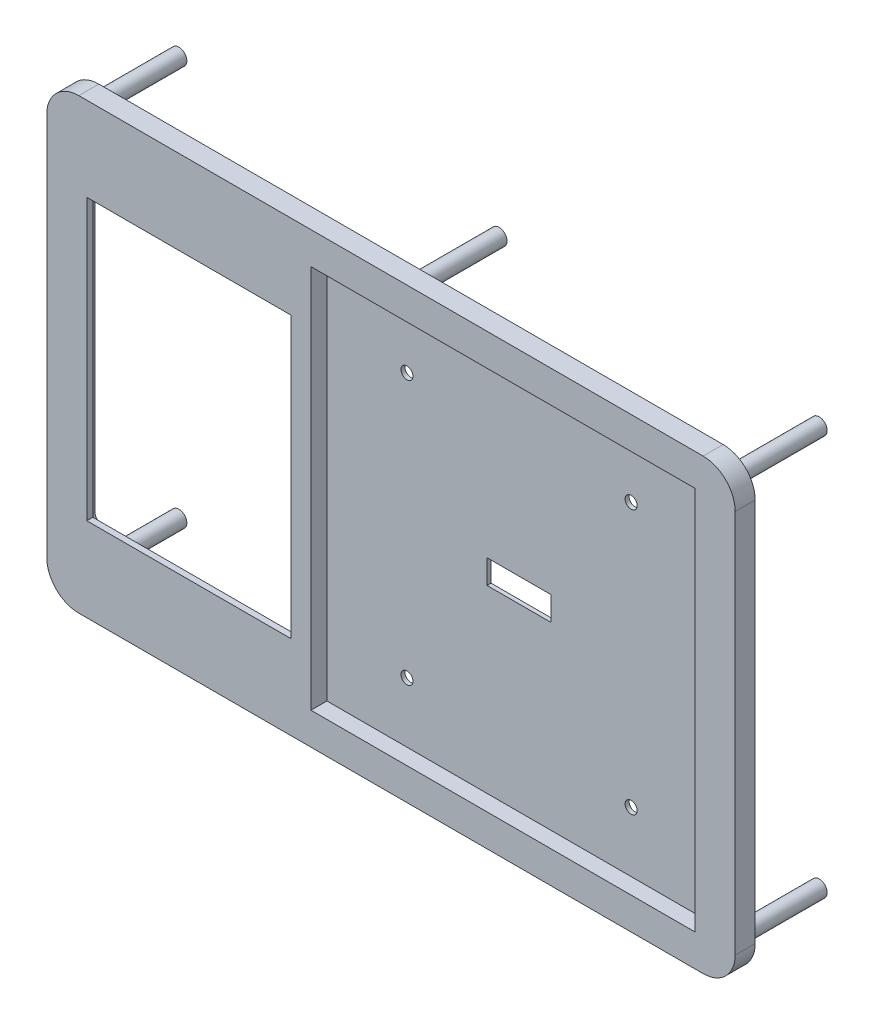
from build123d import *

# Parameters (mm, degrees)
SKETCH_1_W                     = 172
SKETCH_1_H                     = 112
EXTRUDE_1_DEPTH                = 5
FILLET_2_R                     = 8
SHELL_2_T                      = -3
SKETCH_2_W                     = 51
SKETCH_2_H                     = 70
CUT_EXTRUDE_1_DEPTH            = 5
SKETCH_3_W                     = 98
SKETCH_3_H                     = 98
EXTRUDE_2_DEPTH                = 5
SKETCH_4_W                     = 96
SKETCH_4_H                     = 96
CUT_EXTRUDE_2_DEPTH            = 4
SKETCH_8_W                     = 60
SKETCH_8_H                     = 82
SKETCH_8_W_2                   = 56
SKETCH_8_H_2                   = 78
EXTRUDE_1_2_DEPTH              = 2
SKETCH_26_W                    = 56
SKETCH_26_H                    = 78
CUT_EXTRUDE_4_DEPTH            = 3.5
FILLET_3_R                     = 2
FILLET_5_R                     = 2
SKETCH_9_R                     = 2
EXTRUDE_3_DEPTH                = 24
SKETCH_10_R                    = 2
EXTRUDE_4_DEPTH                = 24
SKETCH_11_R                    = 2
EXTRUDE_5_DEPTH                = 24
SKETCH_12_R                    = 2
EXTRUDE_6_DEPTH                = 24
HOLE_WIZARD_M22_AT_2_COUNT     = 2
HOLE_WIZARD_M22_AT_2_PITCH     = 66
HOLE_WIZARD_M22_AT_3_COUNT     = 2
HOLE_WIZARD_M22_AT_3_PITCH     = 86.556340034
HOLE_WIZARD_M22_AT_4_COUNT     = 2
HOLE_WIZARD_M22_AT_4_PITCH     = 56
SKETCH_20_W                    = 16
SKETCH_20_H                    = 6
CUT_EXTRUDE_3_DEPTH            = 207.535711198
SKETCH_22_R                    = 2
EXTRUDE_18_DEPTH               = 24
EXTRUDE_18_2_DEPTH             = 24
HOLE_WIZARD_2_0_2_1_AT_2_COUNT = 2
HOLE_WIZARD_2_0_2_1_AT_2_PITCH = 100
HOLE_WIZARD_2_0_2_1_AT_3_COUNT = 2
HOLE_WIZARD_2_0_2_1_AT_3_PITCH = 188.679622641
HOLE_WIZARD_2_0_2_1_AT_4_COUNT = 2
HOLE_WIZARD_2_0_2_1_AT_4_PITCH = 160
HOLE_WIZARD_2_0_2_1_AT_5_COUNT = 2
HOLE_WIZARD_2_0_2_1_AT_5_PITCH = 80.006249756
HOLE_WIZARD_2_0_2_1_AT_6_COUNT = 2
HOLE_WIZARD_2_0_2_1_AT_6_PITCH = 128.844867961


with BuildPart() as part:
    # Эскиз1 → Extrude 1 (new body)
    with BuildSketch(Plane.XY):
        with Locations((86, 56)):
            Rectangle(SKETCH_1_W, SKETCH_1_H)
    extrude(amount=EXTRUDE_1_DEPTH)

    # Скругление2
    fillet_2_edges = [part.edges().sort_by_distance(p)[0] for p in [
        (0, 112, 2.5),
        (172, 112, 2.5),
        (172, 0, 2.5),
        (0, 0, 2.5),
    ]]
    fillet(fillet_2_edges, radius=FILLET_2_R)

    # Оболочка2
    shell_2_openings = [part.faces().sort_by_distance(p)[0] for p in [
        (86, 56, 0),
    ]]
    offset(amount=SHELL_2_T, openings=shell_2_openings, kind=Kind.INTERSECTION)

    # Эскиз2 → Вырез-Вытянуть1 (cut)
    with BuildSketch(Plane.XY.offset(5)):
        with Locations((35.5, 56)):
            Rectangle(SKETCH_2_W, SKETCH_2_H)
    extrude(amount=-CUT_EXTRUDE_1_DEPTH, mode=Mode.SUBTRACT)

    # Эскиз3 → Бобышка-Вытянуть2 (add)
    with BuildSketch(Plane.XY.offset(5)):
        with Locations((114, 56)):
            Rectangle(SKETCH_3_W, SKETCH_3_H)
    extrude(amount=-EXTRUDE_2_DEPTH)

    # Эскиз4 → Вырез-Вытянуть2 (cut)
    with BuildSketch(Plane.XY.offset(5)):
        with Locations((114, 56)):
            Rectangle(SKETCH_4_W, SKETCH_4_H)
    extrude(amount=-CUT_EXTRUDE_2_DEPTH, mode=Mode.SUBTRACT)

    # Эскиз26 → Вырез-Вытянуть4 (cut)
    with BuildSketch(Plane(origin=(0, 0, 0), x_dir=(-1, 0, 0), z_dir=(0, 0, -1))):
        with Locations((-35, 56)):
            Rectangle(SKETCH_26_W, SKETCH_26_H)
    extrude(amount=-CUT_EXTRUDE_4_DEPTH, mode=Mode.SUBTRACT)

    # Скругление3
    fillet_3_edges = [part.edges().sort_by_distance(p)[0] for p in [
        (63, 17, 2.75),
        (63, 95, 2.75),
        (7, 95, 2.75),
        (7, 17, 2.75),
    ]]
    fillet(fillet_3_edges, radius=FILLET_3_R)

    # Эскиз9 → Бобышка-Вытянуть3 (add)
    with BuildSketch(Plane(origin=(0, 0, 2), x_dir=(-1, 0, 0), z_dir=(0, 0, -1))):
        with Locations((-166, 106)):
            Circle(SKETCH_9_R)
    extrude(amount=EXTRUDE_3_DEPTH)

    # Эскиз10 → Бобышка-Вытянуть4 (add)
    with BuildSketch(Plane(origin=(0, 0, 2), x_dir=(-1, 0, 0), z_dir=(0, 0, -1))):
        with Locations((-166, 6)):
            Circle(SKETCH_10_R)
    extrude(amount=EXTRUDE_4_DEPTH)

    # Эскиз11 → Бобышка-Вытянуть5 (add)
    with BuildSketch(Plane(origin=(0, 0, 2), x_dir=(-1, 0, 0), z_dir=(0, 0, -1))):
        with Locations((-6, 106)):
            Circle(SKETCH_11_R)
    extrude(amount=EXTRUDE_5_DEPTH)

    # Эскиз12 → Бобышка-Вытянуть6 (add)
    with BuildSketch(Plane(origin=(0, 0, 2), x_dir=(-1, 0, 0), z_dir=(0, 0, -1))):
        with Locations((-6, 6)):
            Circle(SKETCH_12_R)
    extrude(amount=EXTRUDE_6_DEPTH)

    # Эскиз15 → Зенковка для  винта с плоской головкой M22 (revolve, cut)
    with BuildSketch(Plane(origin=(86, 89, 1), x_dir=(0, -1, 0), z_dir=(1, 0, 0))):
        Polygon((0, 0), (0, 23), (1.2, 23), (1.2, 1.3), (1.5, 1), (1.5, 0), align=None)
    hole_wizard_m22 = revolve(axis=Axis((86, 89, 7.35), (0, 0, -1)), mode=Mode.SUBTRACT)

    # Зенковка для  винта с плоской головкой M22 at 2: Зенковка для  винта с плоской головкой M22 ×2
    with Locations(*[(0, -i * HOLE_WIZARD_M22_AT_2_PITCH, 0) for i in range(1, HOLE_WIZARD_M22_AT_2_COUNT)]):
        add(hole_wizard_m22, mode=Mode.SUBTRACT)

    # Зенковка для  винта с плоской головкой M22 at 3: Зенковка для  винта с плоской головкой M22 ×2
    with Locations(*[Vector(0.646977448195096, -0.7625091353727915, 0) * (i * HOLE_WIZARD_M22_AT_3_PITCH) for i in range(1, HOLE_WIZARD_M22_AT_3_COUNT)]):
        add(hole_wizard_m22, mode=Mode.SUBTRACT)

    # Зенковка для  винта с плоской головкой M22 at 4: Зенковка для  винта с плоской головкой M22 ×2
    with Locations(*[(i * HOLE_WIZARD_M22_AT_4_PITCH, 0, 0) for i in range(1, HOLE_WIZARD_M22_AT_4_COUNT)]):
        add(hole_wizard_m22, mode=Mode.SUBTRACT)

    # Эскиз20 → Вырез-Вытянуть3 (cut, through all)
    with BuildSketch(Plane.XY.offset(1)):
        with Locations((114, 56)):
            Rectangle(SKETCH_20_W, SKETCH_20_H)
    extrude(amount=-CUT_EXTRUDE_3_DEPTH, mode=Mode.SUBTRACT)

    # Эскиз13 → Диаметр отверстия Ø2.0 (2)1 (revolve, cut)
    with BuildSketch(Plane(origin=(6, 106, -22), x_dir=(0, 1, 0), z_dir=(1, 0, 0))):
        Polygon((0, 0), (0, 15.600860619), (1, 15), (1, 0), align=None)
    hole_wizard_2_0_2_1 = revolve(axis=Axis((6, 106, -28.35), (0, 0, 1)), mode=Mode.SUBTRACT)

    # Диаметр отверстия Ø2.0 (2)1 at 2: Диаметр отверстия Ø2.0 (2)1 ×2
    with Locations(*[(0, -i * HOLE_WIZARD_2_0_2_1_AT_2_PITCH, 0) for i in range(1, HOLE_WIZARD_2_0_2_1_AT_2_COUNT)]):
        add(hole_wizard_2_0_2_1, mode=Mode.SUBTRACT)

    # Диаметр отверстия Ø2.0 (2)1 at 3: Диаметр отверстия Ø2.0 (2)1 ×2
    with Locations(*[Vector(0.847998304005088, -0.52999894000318, 0) * (i * HOLE_WIZARD_2_0_2_1_AT_3_PITCH) for i in range(1, HOLE_WIZARD_2_0_2_1_AT_3_COUNT)]):
        add(hole_wizard_2_0_2_1, mode=Mode.SUBTRACT)

    # Диаметр отверстия Ø2.0 (2)1 at 4: Диаметр отверстия Ø2.0 (2)1 ×2
    with Locations(*[(i * HOLE_WIZARD_2_0_2_1_AT_4_PITCH, 0, 0) for i in range(1, HOLE_WIZARD_2_0_2_1_AT_4_COUNT)]):
        add(hole_wizard_2_0_2_1, mode=Mode.SUBTRACT)


with BuildPart() as body_2:
    # Эскиз8 → Extrude 1 2 (new body)
    with BuildSketch(Plane(origin=(0, 0, 2), x_dir=(-1, 0, 0), z_dir=(0, 0, -1))):
        with Locations((-35, 56)):
            Rectangle(SKETCH_8_W, SKETCH_8_H)
        with Locations((-35, 56)):
            Rectangle(SKETCH_8_W_2, SKETCH_8_H_2, mode=Mode.SUBTRACT)
    extrude(amount=EXTRUDE_1_2_DEPTH)

    # Скругление5
    fillet_5_edges = [body_2.edges().sort_by_distance(p)[0] for p in [
        (63, 95, 1),
        (63, 17, 1),
        (7, 17, 1),
        (7, 95, 1),
    ]]
    fillet(fillet_5_edges, radius=FILLET_5_R)


with BuildPart() as body_3:
    # Эскиз22 → Бобышка-Вытянуть18 (new body)
    with BuildSketch(Plane(origin=(0, 0, 2), x_dir=(-1, 0, 0), z_dir=(0, 0, -1))):
        with Locations((-86, 107)):
            Circle(SKETCH_22_R)
    extrude(amount=EXTRUDE_18_DEPTH)

    # Диаметр отверстия Ø2.0 (2)1 at 5: Диаметр отверстия Ø2.0 (2)1 ×2
    with Locations(*[Vector(0.9999218841540816, 0.012499023551926015, 0) * (i * HOLE_WIZARD_2_0_2_1_AT_5_PITCH) for i in range(1, HOLE_WIZARD_2_0_2_1_AT_5_COUNT)]):
        add(hole_wizard_2_0_2_1, mode=Mode.SUBTRACT)


with BuildPart() as body_4:
    # Эскиз22 → Extrude 18 2 (new body)
    with BuildSketch(Plane(origin=(0, 0, 2), x_dir=(-1, 0, 0), z_dir=(0, 0, -1))):
        with Locations((-86, 5)):
            Circle(SKETCH_22_R)
    extrude(amount=EXTRUDE_18_2_DEPTH)

    # Диаметр отверстия Ø2.0 (2)1 at 6: Диаметр отверстия Ø2.0 (2)1 ×2
    with Locations(*[Vector(0.6209017189877067, -0.7838884202219795, 0) * (i * HOLE_WIZARD_2_0_2_1_AT_6_PITCH) for i in range(1, HOLE_WIZARD_2_0_2_1_AT_6_COUNT)]):
        add(hole_wizard_2_0_2_1, mode=Mode.SUBTRACT)


solid = Compound([part.part, body_2.part, body_3.part, body_4.part])
